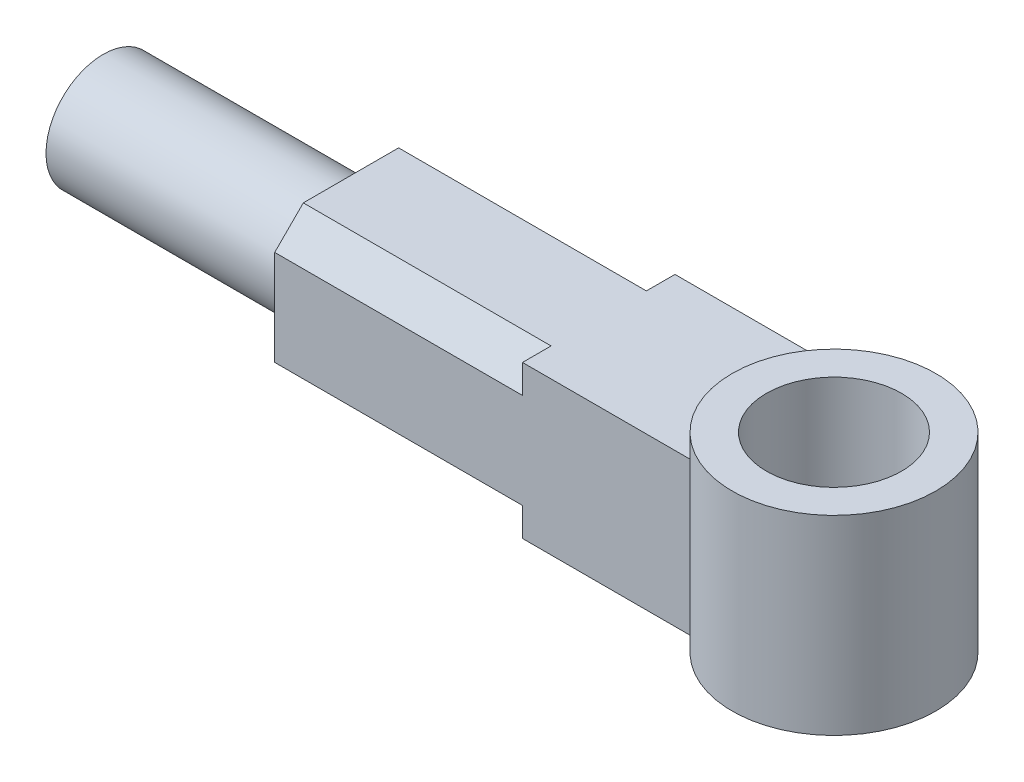
from build123d import *

# Parameters (mm, degrees)
BOSS_EXTRUDE1_DEPTH      = 20
SKETCH2_R                = 26.722222222
SKETCH2_R_2              = 17.722222222
BOSS_EXTRUDE2_DEPTH      = 20
CUT_EXTRUDE1_DEPTH       = 65
SKETCH4_R                = 15
BOSS_EXTRUDE3_DEPTH      = 65
CIRPATTERN1_COUNT        = 4
CUT_EXTRUDE2_DEPTH       = 216.315330002
CUT_EXTRUDE2_DEPTH_BACK  = 216.315330002
SKETCH5_W                = 98.755733185
SKETCH5_H                = 100
MOVE_FACE1_BY            = 9
BOSS_EXTRUDE4_DEPTH      = 5
BOSS_EXTRUDE4_DEPTH_BACK = 45
SKETCH6_R                = 26.722222222
SKETCH6_R_2              = 17.722222222


with BuildPart() as part:
    # Sketch1 → Boss-Extrude1 (new, symmetric)
    with BuildSketch(Plane.XY):
        with BuildLine():
            Line((-140.311288741, 0), (-45, 0))
            ThreePointArc((-45, 0), (-43.812144397, 10.271124735), (-40.311288741, 20))
            Line((-40.311288741, 20), (-140.311288741, 20))
            Line((-140.311288741, 20), (-140.311288741, 0))
        make_face()
        with BuildLine():
            ThreePointArc((-40.311288741, -20), (-43.812144397, -10.271124735), (-45, 0))
            Line((-45, 0), (-140.311288741, 0))
            Line((-140.311288741, 0), (-140.311288741, -20))
            Line((-140.311288741, -20), (-40.311288741, -20))
        make_face()
        with BuildLine():
            ThreePointArc((-25, 0), (-17.67766953, 17.67766953), (0, 25))
            Line((0, 25), (9, 25))
            Line((9, 25), (9, 45))
            Line((9, 45), (0, 45))
            ThreePointArc((0, 45), (-23.717082451, 38.242646352), (-40.311288741, 20))
            ThreePointArc((-40.311288741, 20), (-43.812144397, 10.271124735), (-45, 0))
            Line((-45, 0), (-25, 0))
        make_face()
        with BuildLine():
            ThreePointArc((0, -25), (-17.67766953, -17.67766953), (-25, 0))
            Line((-25, 0), (-45, 0))
            ThreePointArc((-45, 0), (-43.812144397, -10.271124735), (-40.311288741, -20))
            ThreePointArc((-40.311288741, -20), (-23.717082451, -38.242646352), (0, -45))
            Line((0, -45), (9, -45))
            Line((9, -45), (9, -25))
            Line((9, -25), (0, -25))
        make_face()
    extrude(amount=BOSS_EXTRUDE1_DEPTH, both=True)

    # Sketch2 → Boss-Extrude2 (add)
    with BuildSketch(Plane(origin=(0, 45, 0), x_dir=(1, 0, 0), z_dir=(0, 1, 0))):
        with Locations((26.722222222, 0)):
            Circle(SKETCH2_R)
        with Locations(Location((26.722222222, 0, 0), (0, 0, 270))):
            Circle(SKETCH2_R_2, mode=Mode.SUBTRACT)
    boss_extrude2 = extrude(amount=-BOSS_EXTRUDE2_DEPTH)

    # Mirror1: Boss-Extrude2 across plane
    add(boss_extrude2.mirror(Plane.ZX))

    # Sketch3 → Cut-Extrude1 (cut)
    with BuildSketch(Plane.ZY.offset(140.311288741)):
        Polygon((-12.5, 20), (-20, 20), (-20, 12.5), align=None)
    cut_extrude1 = extrude(amount=-CUT_EXTRUDE1_DEPTH, mode=Mode.SUBTRACT)

    # Sketch4 → Boss-Extrude3 (add)
    with BuildSketch(Plane.ZY.offset(140.311288741)):
        with Locations(Location((0, 0, 0), (0, 0, 180))):
            Circle(SKETCH4_R)
    extrude(amount=BOSS_EXTRUDE3_DEPTH)

    # CirPattern1: Cut-Extrude1 ×4 about axis
    cirpattern1_axis = Axis((0, 0, 0), (1, 0, 0))
    for i in range(1, CIRPATTERN1_COUNT):
        add(cut_extrude1.rotate(cirpattern1_axis, i * 360 / CIRPATTERN1_COUNT), mode=Mode.SUBTRACT)

    # Sketch5 → Cut-Extrude2 (cut, two sides: drawn at the far end of the back side and taken through both)
    with BuildSketch(Plane.XY.offset(20).offset(-CUT_EXTRUDE2_DEPTH_BACK)):
        with Locations((9.066577851, 0)):
            Rectangle(SKETCH5_W, SKETCH5_H)
    extrude(amount=CUT_EXTRUDE2_DEPTH + CUT_EXTRUDE2_DEPTH_BACK, mode=Mode.SUBTRACT)

    # Move Face1: a face moved outward by 9.0
    extrude(part.faces().sort_by_distance((-40.311288741, 0, 0))[0], amount=MOVE_FACE1_BY, dir=(1, 0, 0))

    # Sketch6 → Boss-Extrude4 (add, two sides: drawn at the far end of the back side and taken through both)
    with BuildSketch(Plane(origin=(0, 20, 0), x_dir=(1, 0, 0), z_dir=(0, 1, 0)).offset(-BOSS_EXTRUDE4_DEPTH_BACK)):
        with Locations(Location((-13.589066519, 0, 0), (0, 0, 180))):
            Circle(SKETCH6_R)
        with Locations(Location((-13.589066519, 0, 0), (0, 0, 180))):
            Circle(SKETCH6_R_2, mode=Mode.SUBTRACT)
    extrude(amount=BOSS_EXTRUDE4_DEPTH + BOSS_EXTRUDE4_DEPTH_BACK)


solid = part.part
